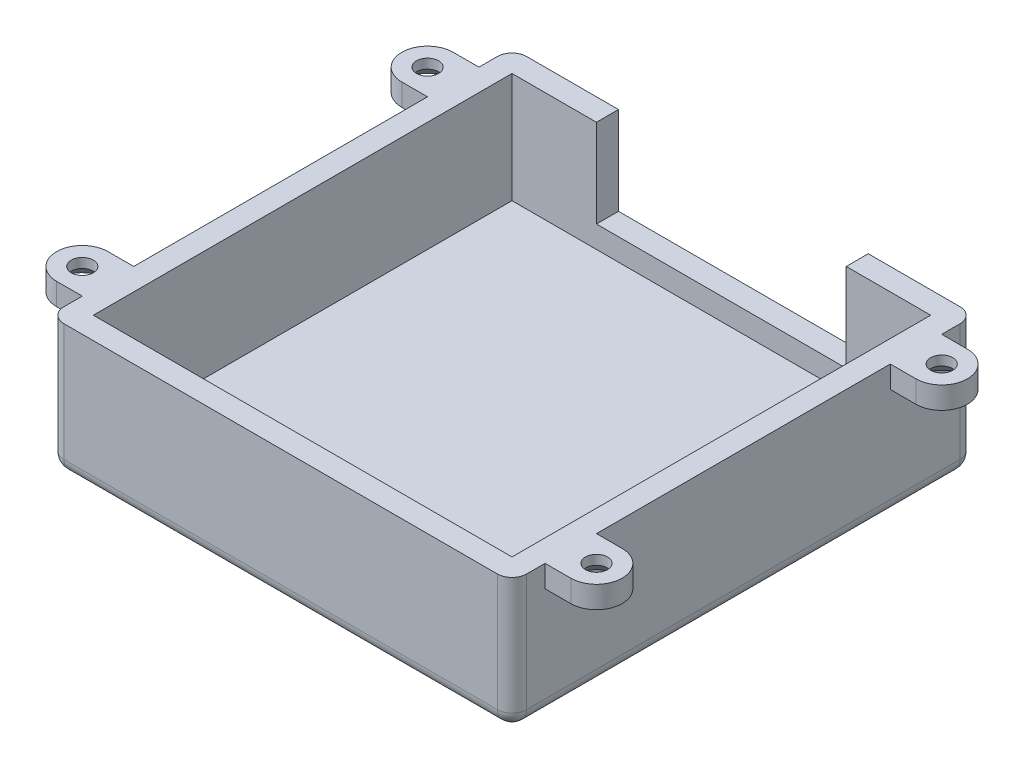
from build123d import *

# Parameters (mm, degrees)
SKETCH1_W           = 63
SKETCH1_H           = 63
BOSS_EXTRUDE1_DEPTH = 18
SHELL2_T            = -3
SKETCH2_W           = 34
SKETCH2_H           = 12
CUT_EXTRUDE1_DEPTH  = 3
FILLET2_R           = 2
SKETCH4_R           = 1.5
BOSS_EXTRUDE2_DEPTH = 3
CHAMFER1_SIZE       = 1.7


with BuildPart() as part:
    # Sketch1 → Boss-Extrude1 (new body)
    with BuildSketch(Plane(origin=(0, 0, 0), x_dir=(1, 0, 0), z_dir=(0, 1, 0))):
        with Locations((31.5, 31.5)):
            Rectangle(SKETCH1_W, SKETCH1_H)
    extrude(amount=BOSS_EXTRUDE1_DEPTH)

    # Shell2
    shell2_openings = [part.faces().sort_by_distance(p)[0] for p in [
        (31.5, 18, -31.5),
    ]]
    offset(amount=SHELL2_T, openings=shell2_openings, kind=Kind.INTERSECTION)

    # Sketch2 → Cut-Extrude1 (cut)
    with BuildSketch(Plane(origin=(0, 0, -63), x_dir=(-1, 0, 0), z_dir=(0, 0, -1))):
        with Locations((-31.5, 12)):
            Rectangle(SKETCH2_W, SKETCH2_H)
    extrude(amount=-CUT_EXTRUDE1_DEPTH, mode=Mode.SUBTRACT)

    # Fillet2
    fillet2_edges = [part.edges().sort_by_distance(p)[0] for p in [
        (31.5, 0, -63),
        (63, 0, -31.5),
        (31.5, 0, 0),
        (0, 0, -31.5),
        (0, 9, -63),
        (63, 9, -63),
        (63, 9, 0),
        (0, 9, 0),
    ]]
    fillet(fillet2_edges, radius=FILLET2_R)

    # Sketch4 → Boss-Extrude2 (add)
    # profile 1 of 4: a face of its own
    with BuildSketch(Plane(origin=(0, 18, 0), x_dir=(1, 0, 0), z_dir=(0, 1, 0))):
        with BuildLine():
            Line((0, 58.5), (0, 51.5))
            Line((0, 51.5), (-3.5, 51.5))
            ThreePointArc((-3.5, 51.5), (-7, 55), (-3.5, 58.5))
            Line((-3.5, 58.5), (0, 58.5))
        make_face()
        with Locations(Location((-3.5, 55, 0), (0, 0, 270))):
            Circle(SKETCH4_R, mode=Mode.SUBTRACT)
    # profile 2 of 4: a face of its own
    with BuildSketch(Plane(origin=(0, 18, 0), x_dir=(1, 0, 0), z_dir=(0, 1, 0))):
        with BuildLine():
            Line((66.5, 51.5), (63, 51.5))
            Line((63, 51.5), (63, 58.5))
            Line((63, 58.5), (66.5, 58.5))
            ThreePointArc((66.5, 58.5), (70, 55), (66.5, 51.5))
        make_face()
        with Locations(Location((66.5, 55, 0), (0, 0, 90))):
            Circle(SKETCH4_R, mode=Mode.SUBTRACT)
    # profile 3 of 4: a face of its own
    with BuildSketch(Plane(origin=(0, 18, 0), x_dir=(1, 0, 0), z_dir=(0, 1, 0))):
        with BuildLine():
            Line((63, 4.5), (63, 11.5))
            Line((63, 11.5), (66.5, 11.5))
            ThreePointArc((66.5, 11.5), (70, 8), (66.5, 4.5))
            Line((66.5, 4.5), (63, 4.5))
        make_face()
        with Locations(Location((66.5, 8, 0), (0, 0, 270))):
            Circle(SKETCH4_R, mode=Mode.SUBTRACT)
    # profile 4 of 4: a face of its own
    with BuildSketch(Plane(origin=(0, 18, 0), x_dir=(1, 0, 0), z_dir=(0, 1, 0))):
        with BuildLine():
            Line((-3.5, 11.5), (0, 11.5))
            Line((0, 11.5), (0, 4.5))
            Line((0, 4.5), (-3.5, 4.5))
            ThreePointArc((-3.5, 4.5), (-7, 8), (-3.5, 11.5))
        make_face()
        with Locations(Location((-3.5, 8, 0), (0, 0, 90))):
            Circle(SKETCH4_R, mode=Mode.SUBTRACT)
    extrude(amount=-BOSS_EXTRUDE2_DEPTH)

    # Chamfer1
    chamfer1_edges = [part.edges().sort_by_distance(p)[0] for p in [
        (66.5, 15, -9.5),
        (-3.5, 15, -6.5),
        (-3.5, 15, -56.5),
        (66.5, 15, -53.5),
    ]]
    chamfer(chamfer1_edges, length=CHAMFER1_SIZE)


solid = part.part
